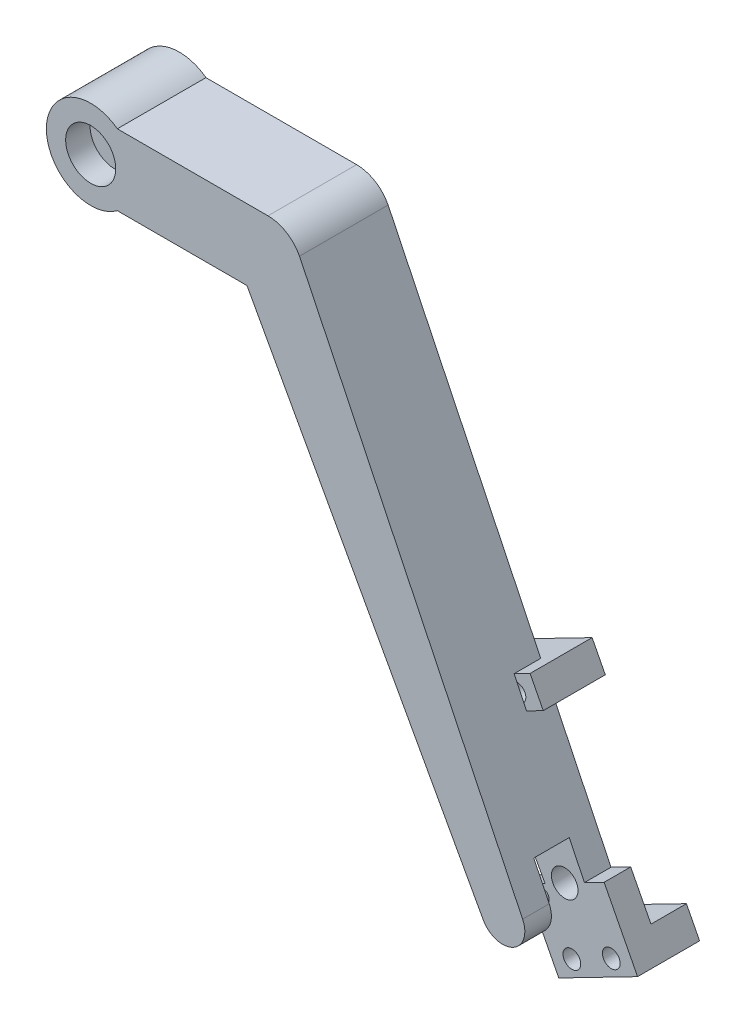
from build123d import *

# Parameters (mm, degrees)
EXTRUDE_1_DEPTH     = 20
SKETCH_2_R          = 5.65
CUT_EXTRUDE_1_DEPTH = 5.5
CUT_EXTRUDE_START   = -6
CUT_EXTRUDE_4_DEPTH = 8
EXTRUDE_START       = 5
SKETCH_5_R          = 1.5
EXTRUDE_2_DEPTH     = 3
CUT_EXTRUDE_5_REACH = 149.085
SKETCH_7_R          = 3
EXTRUDE_3_DEPTH     = 6
EXTRUDE_4_DEPTH     = 8
EXTRUDE_5_DEPTH     = 8
EXTRUDE_6_DEPTH     = 6
SKETCH_12_R         = 2
CUT_EXTRUDE_7_DEPTH = 14


with BuildPart() as part:
    # 草图1 → 凸台-拉伸1 (new body)
    with BuildSketch(Plane.XY):
        with BuildLine():
            Line((35.26398638, -8), (88.563757686, -105.288040462))
            ThreePointArc((88.563757686, -105.288040462), (95.239080336, -107.332125442), (97.455297675, -100.711959538))
            Line((97.455297675, -100.711959538), (47.113231991, 3.660864739))
            ThreePointArc((47.113231991, 3.660864739), (44.166118222, 6.829601669), (40, 8))
            Line((40, 8), (6, 8))
            ThreePointArc((6, 8), (-10, 0), (6, -8))
            Line((6, -8), (35.26398638, -8))
        make_face()
    extrude(amount=EXTRUDE_1_DEPTH)

    # 草图2 → 切除-拉伸1 (cut)
    with BuildSketch(Plane.XY.offset(20)):
        Circle(SKETCH_2_R)
    extrude(amount=-CUT_EXTRUDE_1_DEPTH, mode=Mode.SUBTRACT)

    # 草图4 → 切除-拉伸4 (cut)
    with BuildSketch(Plane(origin=(0, 0, 0), x_dir=(-1, 0, 0), z_dir=(0, 0, -1)).offset(CUT_EXTRUDE_START)):
        with BuildLine():
            Line((-97.455297675, -100.711959538), (-93.978649208, -93.503919609))
            Line((-93.978649208, -93.503919609), (-84.718676675, -98.269616408))
            Line((-84.718676675, -98.269616408), (-88.563757686, -105.288040462))
            ThreePointArc((-88.563757686, -105.288040462), (-95.297568142, -107.445769995), (-97.455297675, -100.711959538))
        make_face()
    extrude(amount=-CUT_EXTRUDE_4_DEPTH, mode=Mode.SUBTRACT)

    # 草图5 → 凸台-拉伸2 (add)
    with BuildSketch(Plane.XY.offset(6).offset(EXTRUDE_START)):
        with Locations((92.950272719, -102.88486483)):
            Circle(SKETCH_5_R)
    extrude(amount=EXTRUDE_2_DEPTH)

    # 草图7 → 切除-拉伸5 (cut, up to next)
    with BuildSketch(Plane(origin=(0, 0, 0), x_dir=(-1, 0, 0), z_dir=(0, 0, -1)), mode=Mode.PRIVATE) as cut_extrude_5_sk1:
        with Locations((-92.950272719, -102.88486483)):
            Circle(SKETCH_7_R)
    cut_extrude_5_tool1 = extrude(cut_extrude_5_sk1.sketch, amount=-CUT_EXTRUDE_5_REACH, mode=Mode.PRIVATE) & part.part
    add(cut_extrude_5_tool1.solids().sort_by_distance((92.950273, -102.884865, 0))[0], mode=Mode.SUBTRACT)

    # 草图8 → 凸台-拉伸3 (add)
    with BuildSketch(Plane(origin=(0, 0, 0), x_dir=(-1, 0, 0), z_dir=(0, 0, -1))):
        with BuildLine():
            Line((-95.617734716, -101.512040553), (-101.841812708, -98.308783906))
            Line((-101.841812708, -98.308783906), (-109.392346233, -112.979824888))
            Line((-109.392346233, -112.979824888), (-91.609266255, -122.131986736))
            Line((-91.609266255, -122.131986736), (-84.05873273, -107.460945754))
            Line((-84.05873273, -107.460945754), (-90.282810723, -104.257689107))
            ThreePointArc((-90.282810723, -104.257689107), (-94.323096996, -105.552326827), (-95.617734716, -101.512040553))
        make_face()
    extrude(amount=-EXTRUDE_3_DEPTH)

    # 草图9 → 凸台-拉伸4 (add)
    with BuildSketch(Plane(origin=(0, 0, 0), x_dir=(-1, 0, 0), z_dir=(0, 0, -1))):
        Polygon((-106.417893632, -107.200323895), (-88.634813654, -116.352485743), (-91.609266255, -122.131986736), (-109.392346233, -112.979824888), align=None)
    extrude(amount=EXTRUDE_4_DEPTH)

    # 草图10 → 凸台-拉伸5 (add)
    with BuildSketch(Plane(origin=(0, 0, 0), x_dir=(-1, 0, 0), z_dir=(0, 0, -1))):
        Polygon((-88.113569936, -71.634163939), (-70.330489958, -80.786325787), (-67.356037358, -75.006824794), (-85.139117336, -65.854662946), align=None)
    extrude(amount=EXTRUDE_5_DEPTH)

    # 草图11 → 凸台-拉伸6 (add)
    with BuildSketch(Plane.XY):
        Polygon((81.536815817, -67.708607626), (84.361592697, -73.565140068), (88.113569936, -71.634163939), (85.139117336, -65.854662946), align=None)
        Polygon((67.356037358, -75.006824794), (70.330489958, -80.786325787), (74.082467198, -78.855349657), (70.958338877, -73.152880114), align=None)
    extrude(amount=EXTRUDE_6_DEPTH)

    # 草图12 → 切除-拉伸7 (cut)
    with BuildSketch(Plane(origin=(0, 0, -8), x_dir=(-1, 0, 0), z_dir=(0, 0, -1))):
        with Locations((-103.459349938, -112.378114854)):
            Circle(SKETCH_12_R)
        with Locations((-94.567809949, -116.954195778)):
            Circle(SKETCH_12_R)
        with Locations((-73.289033653, -75.608534828)):
            Circle(SKETCH_12_R)
        with Locations(Location((-82.180573642, -71.032453904, 0), (0, 0, 89.850321616))):
            Circle(SKETCH_12_R)
    extrude(amount=-CUT_EXTRUDE_7_DEPTH, mode=Mode.SUBTRACT)


solid = part.part
